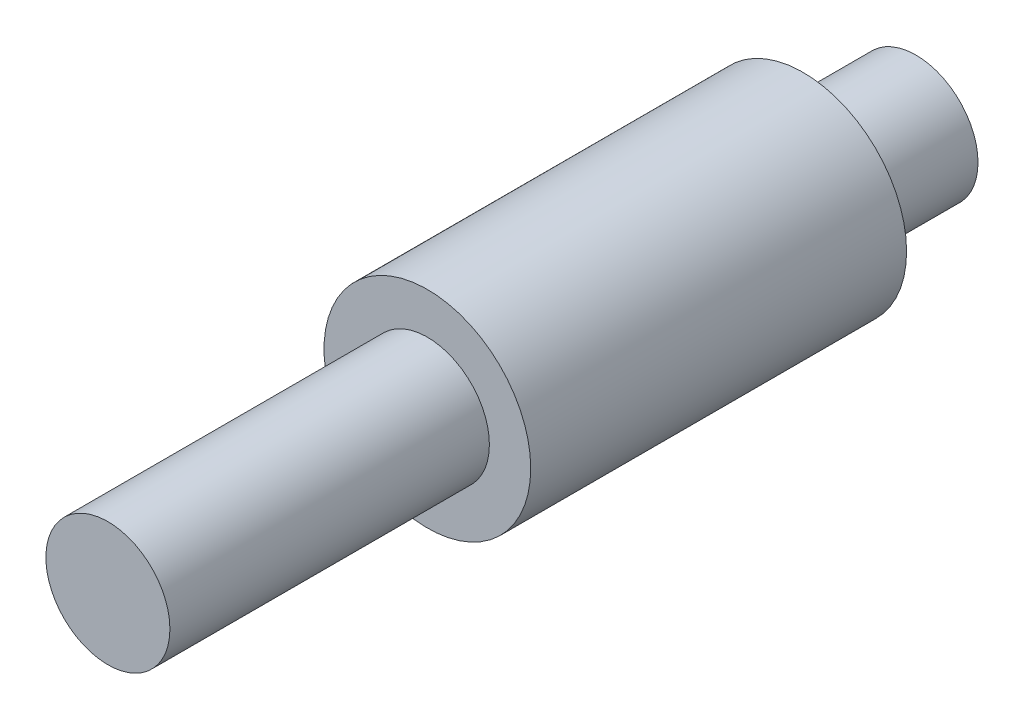
from build123d import *


with BuildPart() as part:
    # 草图1 → 旋转1 (revolve)
    with BuildSketch(Plane(origin=(0, 0, 0), x_dir=(1, 0, 0), z_dir=(0, 1, 0))):
        Polygon((3.3, 0), (0, 0), (0, -43), (3.3, -43), (3.3, -26), (5.5, -26), (5.5, -6), (3.3, -6), align=None)
    revolve(axis=Axis((0, 0, 0), (0, 0, 1)))


solid = part.part
